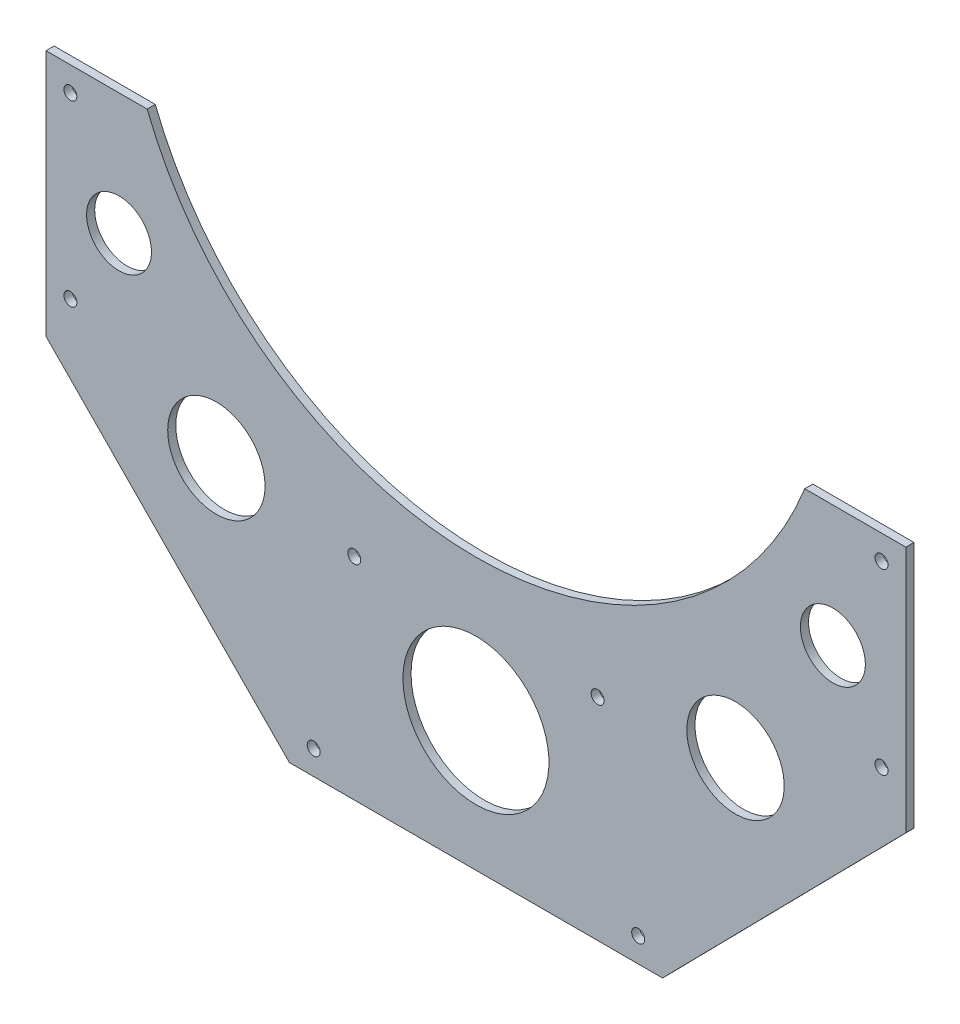
from build123d import *

# Parameters (mm, degrees)
SKETCH_1_W                  = 1060
SKETCH_1_H                  = 610
EXTRUDE_1_DEPTH             = 10
CUT_EXTRUDE_2_DEPTH         = 10
HOLE_WIZARD_16_0_16_1_D     = 16
HOLE_WIZARD_16_0_16_1_DEPTH = 42
HOLE_WIZARD_16_0_16_1_TIP   = 4.806884952
SKETCH_6_R                  = 40
SKETCH_6_R_2                = 60
SKETCH_6_R_3                = 90
CUT_EXTRUDE_3_DEPTH         = 1224.029026638


with BuildPart() as part:
    # 草图1 → 凸台-拉伸1 (new body)
    with BuildSketch(Plane.XY):
        with Locations((530, 305)):
            Rectangle(SKETCH_1_W, SKETCH_1_H)
    extrude(amount=EXTRUDE_1_DEPTH)

    # 草图3 → 切除-拉伸2 (cut)
    with BuildSketch(Plane.XY.offset(10)):
        Polygon((0, 305), (300, 0), (0, 0), align=None)
        Polygon((1060, 305), (760, 0), (1060, 0), align=None)
        with BuildLine():
            Line((935.312302429, 610), (124.687697571, 610))
            ThreePointArc((124.687697571, 610), (530, 334.25), (935.312302429, 610))
        make_face()
    extrude(amount=-CUT_EXTRUDE_2_DEPTH, mode=Mode.SUBTRACT)

    # Ø16.0 (16) 直径孔1
    with Locations(Plane(origin=(0, 0, 0), x_dir=(-1, 0, 0), z_dir=(0, 0, -1))):
        with Locations((-1030, 580), (-1030, 360), (-730, 30), (-330, 30), (-30, 360), (-30, 580), (-680, 260), (-380, 260)):
            Hole(HOLE_WIZARD_16_0_16_1_D / 2, depth=HOLE_WIZARD_16_0_16_1_DEPTH)
            with Locations((0, 0, -(HOLE_WIZARD_16_0_16_1_DEPTH + HOLE_WIZARD_16_0_16_1_TIP / 2))):  # 118° drill point
                Cone(0, HOLE_WIZARD_16_0_16_1_D / 2, HOLE_WIZARD_16_0_16_1_TIP, mode=Mode.SUBTRACT)

    # 草图6 → 切除-拉伸3 (cut, through all)
    with BuildSketch(Plane(origin=(0, 0, 0), x_dir=(-1, 0, 0), z_dir=(0, 0, -1))):
        with Locations((-970, 460)):
            Circle(SKETCH_6_R)
        with Locations((-850, 280)):
            Circle(SKETCH_6_R_2)
        with Locations((-530, 160)):
            Circle(SKETCH_6_R_3)
        with Locations((-210, 280)):
            Circle(SKETCH_6_R_2)
        with Locations((-90, 460)):
            Circle(SKETCH_6_R)
    extrude(amount=-CUT_EXTRUDE_3_DEPTH, mode=Mode.SUBTRACT)


solid = part.part
